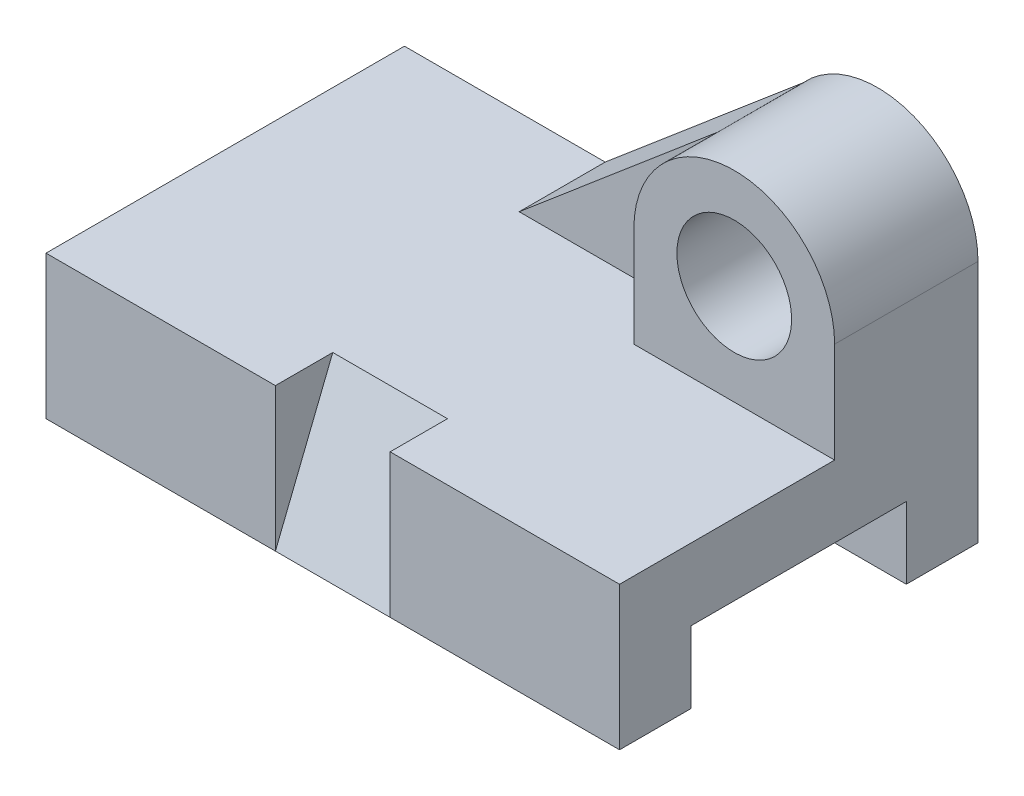
from build123d import *

# Parameters (mm, degrees)
SKETCH1_W           = 200
SKETCH1_H           = 125
BOSS_EXTRUDE2_DEPTH = 50
SKETCH3_R           = 20
BOSS_EXTRUDE5_DEPTH = 50
SKETCH6_W           = 75
SKETCH6_H           = 25
CUT_EXTRUDE1_DEPTH  = 242.466871434
BOSS_EXTRUDE6_DEPTH = 30
SKETCH8_W           = 40
SKETCH8_H           = 50
CUT_EXTRUDE2_DEPTH  = 20
BOSS_EXTRUDE7_DEPTH = 40


with BuildPart() as part:
    # Sketch1 → Boss-Extrude2 (new body)
    with BuildSketch(Plane(origin=(0, 0, 0), x_dir=(1, 0, 0), z_dir=(0, 1, 0))):
        Rectangle(SKETCH1_W, SKETCH1_H)
    extrude(amount=BOSS_EXTRUDE2_DEPTH)

    # Sketch3 → Boss-Extrude5 (add)
    with BuildSketch(Plane(origin=(0, 0, -62.5), x_dir=(-1, 0, 0), z_dir=(0, 0, -1))):
        with BuildLine():
            Line((-100, 50), (-100, 85))
            ThreePointArc((-100, 85), (-65, 120), (-30, 85))
            Line((-30, 85), (-30, 50))
            Line((-30, 50), (-100, 50))
        make_face()
        with Locations((-65, 85)):
            Circle(SKETCH3_R, mode=Mode.SUBTRACT)
    extrude(amount=-BOSS_EXTRUDE5_DEPTH)

    # Sketch6 → Cut-Extrude1 (cut, through all)
    with BuildSketch(Plane.ZY.offset(100)):
        with Locations((0, 12.5)):
            Rectangle(SKETCH6_W, SKETCH6_H)
    extrude(amount=-CUT_EXTRUDE1_DEPTH, mode=Mode.SUBTRACT)

    # Sketch7 → Boss-Extrude6 (add)
    with BuildSketch(Plane(origin=(0, 0, -62.5), x_dir=(-1, 0, 0), z_dir=(0, 0, -1))):
        with BuildLine():
            Line((-39.10827581, 108.550342215), (30, 50))
            Line((30, 50), (-30, 50))
            Line((-30, 50), (-30, 85))
            ThreePointArc((-30, 85), (-32.356391539, 97.625166402), (-39.10827581, 108.550342215))
        make_face()
    extrude(amount=-BOSS_EXTRUDE6_DEPTH)

    # Sketch8 → Cut-Extrude2 (cut)
    with BuildSketch(Plane.XY.offset(62.5)):
        with Locations((0, 25)):
            Rectangle(SKETCH8_W, SKETCH8_H)
    extrude(amount=-CUT_EXTRUDE2_DEPTH, mode=Mode.SUBTRACT)

    # Sketch9 → Boss-Extrude7 (add)
    with BuildSketch(Plane.ZY.offset(-20)):
        Polygon((42.5, 50), (62.5, 0), (42.5, 0), align=None)
    extrude(amount=BOSS_EXTRUDE7_DEPTH)


solid = part.part
